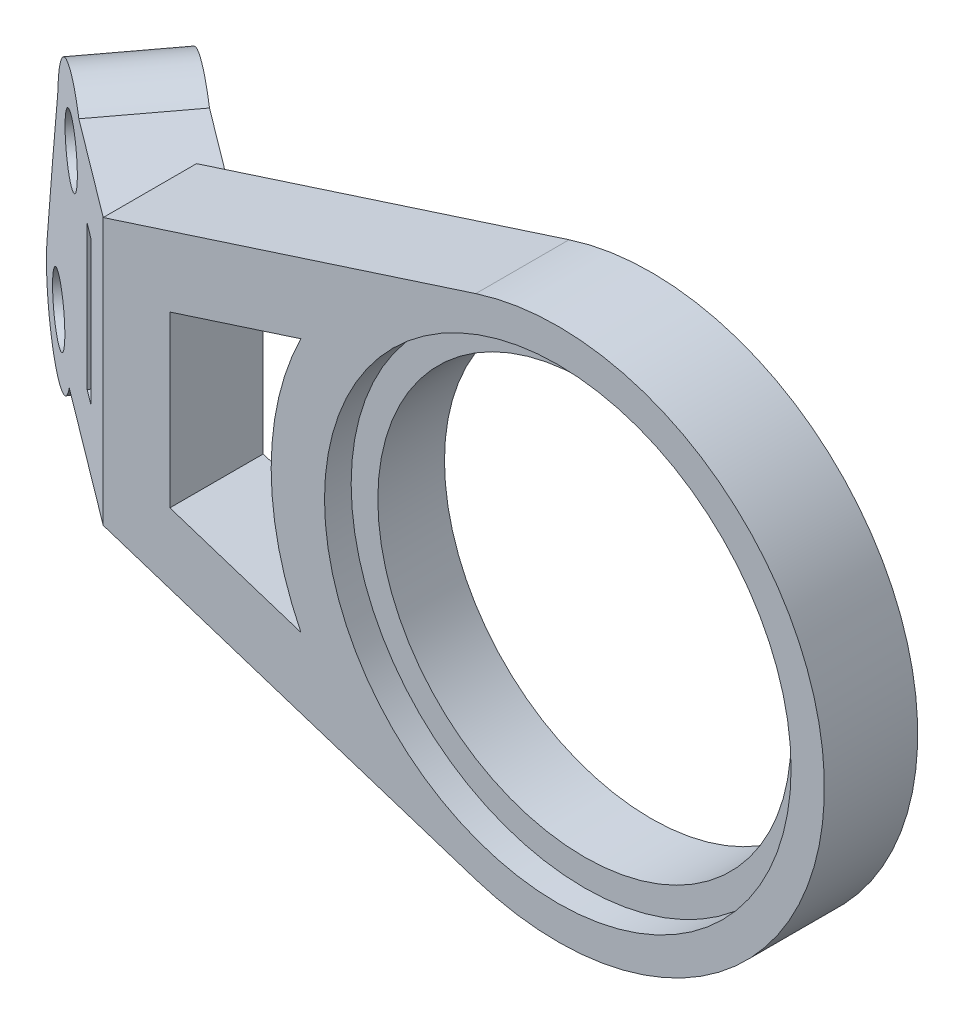
from build123d import *

# Parameters (mm, degrees)
SKETCH_1_R           = 7.75
EXTRUDE_1_DEPTH      = 3.5
SKETCH_2_R           = 8.75
CUT_EXTRUDE_1_DEPTH  = 1
EXTRUDE_2_DEPTH      = 5
SKETCH_8_W           = 0.720416832
SKETCH_8_H           = 5.4
CUT_EXTRUDE_6_DEPTH  = 26.612556655
EXTRUDE_6_DEPTH      = 3.5
SKETCH_4_9_R         = 1.15
CUT_EXTRUDE_9_DEPTH  = 27.034467236
CUT_EXTRUDE_10_DEPTH = 3.5


with BuildPart() as part:
    # 草图1 → 凸台-拉伸1 (new body)
    with BuildSketch(Plane.XY):
        with BuildLine():
            Line((-3.074847287, 9.515530157), (-17.048765133, 5))
            Line((-17.048765133, 5), (-17.048765133, -5))
            Line((-17.048765133, -5), (-3.074847287, -9.515530157))
            ThreePointArc((-3.074847287, -9.515530157), (10, 0), (-3.074847287, 9.515530157))
        make_face()
        Circle(SKETCH_1_R, mode=Mode.SUBTRACT)
        with BuildLine():
            Line((-14.548765133, 3.180565718), (-14.548765133, -3.180565718))
            Line((-14.548765133, -3.180565718), (-9.63448381, -4.768566002))
            ThreePointArc((-9.63448381, -4.768566002), (-10.75, 0), (-9.63448381, 4.768566002))
            Line((-9.63448381, 4.768566002), (-14.548765133, 3.180565718))
        make_face(mode=Mode.SUBTRACT)
    extrude(amount=EXTRUDE_1_DEPTH)

    # 草图2 → 切除-拉伸1 (cut)
    with BuildSketch(Plane.XY.offset(3.5)):
        Circle(SKETCH_2_R)
    extrude(amount=-CUT_EXTRUDE_1_DEPTH, mode=Mode.SUBTRACT)

    # 草图3 → 凸台-拉伸2 (add, symmetric)
    with BuildSketch(Plane(origin=(0, 0, 0), x_dir=(1, 0, 0), z_dir=(0, 1, 0))):
        Polygon((-17.048765133, -3.5), (-24.66318775, 2.214797011), (-22.562251427, 5.014094523), (-15.881448124, 0), align=None)
    extrude(amount=EXTRUDE_2_DEPTH, both=True)

    # 草图8 → 切除-拉伸6 (cut, through all)
    with BuildSketch(Plane(origin=(-7.82335713, 0, 10.423878111), x_dir=(0.7997992893547787, 0, 0.6002675209834286), z_dir=(-0.6002675209834286, 0, 0.7997992893547787))):
        with Locations((-14.194862331, 0)):
            Rectangle(SKETCH_8_W, SKETCH_8_H)
    extrude(amount=-CUT_EXTRUDE_6_DEPTH, mode=Mode.SUBTRACT)

    # 草图4 → 凸台-拉伸6 (add)
    with BuildSketch(Plane(origin=(-7.82335713, 0, 10.423878111), x_dir=(0.7997992893547787, 0, 0.6002675209834286), z_dir=(-0.6002675209834286, 0, 0.7997992893547787))):
        with BuildLine():
            Line((-19.939913719, 3.705712142), (-22.099126281, -3.159985282))
            ThreePointArc((-22.099126281, -3.159985282), (-20.830616239, -5.955555875), (-17.913212318, -5))
            Line((-17.913212318, -5), (-17.348837919, 1.241173708))
            Line((-17.348837919, 1.241173708), (-16.116035743, 2.269506831))
            Line((-16.116035743, 2.269506831), (-16.116035743, 5))
            ThreePointArc((-16.116035743, 5), (-18.356590206, 5.323726244), (-19.939913719, 3.705712142))
        make_face()
    extrude(amount=-EXTRUDE_6_DEPTH)

    # 草图4<9> → 切除-拉伸9 (cut, through all)
    with BuildSketch(Plane(origin=(-7.82335713, 0, 10.423878111), x_dir=(0.7997992893547787, 0, 0.6002675209834286), z_dir=(-0.6002675209834286, 0, 0.7997992893547787))):
        with Locations((-17.555070747, 2.955696144)):
            Circle(SKETCH_4_9_R)
        with Locations((-19.905070747, -3.85)):
            Circle(SKETCH_4_9_R)
    extrude(amount=-CUT_EXTRUDE_9_DEPTH, mode=Mode.SUBTRACT)

    # 草图9 → 切除-拉伸10 (cut)
    with BuildSketch(Plane(origin=(-7.82335713, 0, 10.423878111), x_dir=(0.7997992893547787, 0, 0.6002675209834286), z_dir=(-0.6002675209834286, 0, 0.7997992893547787))):
        with BuildLine():
            Line((-21.055070747, 0.15982191), (-20.046766168, 3.15929852))
            ThreePointArc((-20.046766168, 3.15929852), (-19.725256431, 4.196781997), (-18.994105751, 5))
            Line((-18.994105751, 5), (-18.994105751, 5.471830363))
            Line((-18.994105751, 5.471830363), (-21.906262893, 5.471830363))
            Line((-21.906262893, 5.471830363), (-21.906262893, 0.15982191))
            Line((-21.906262893, 0.15982191), (-21.055070747, 0.15982191))
        make_face()
    extrude(amount=-CUT_EXTRUDE_10_DEPTH, mode=Mode.SUBTRACT)


solid = part.part
